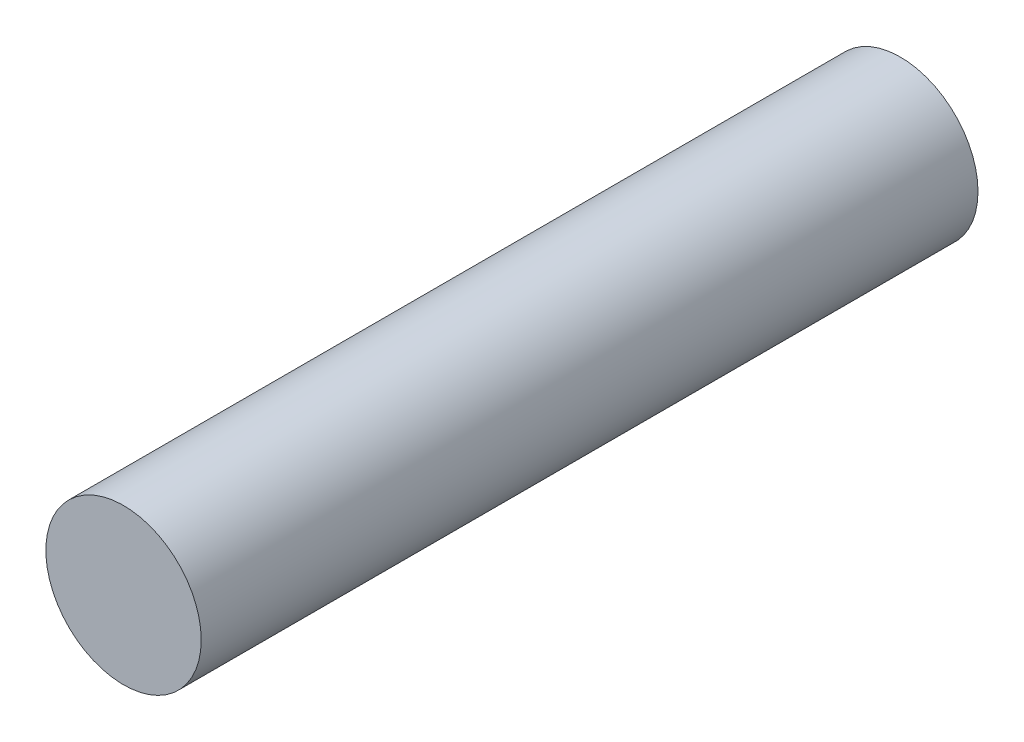
from build123d import *

# Parameters (mm, degrees)
SKETCH1_R           = 3.81
BOSS_EXTRUDE1_DEPTH = 38.1


with BuildPart() as part:
    # Sketch1 → Boss-Extrude1 (new body)
    with BuildSketch(Plane.XY):
        Circle(SKETCH1_R)
    extrude(amount=-BOSS_EXTRUDE1_DEPTH)


solid = part.part
